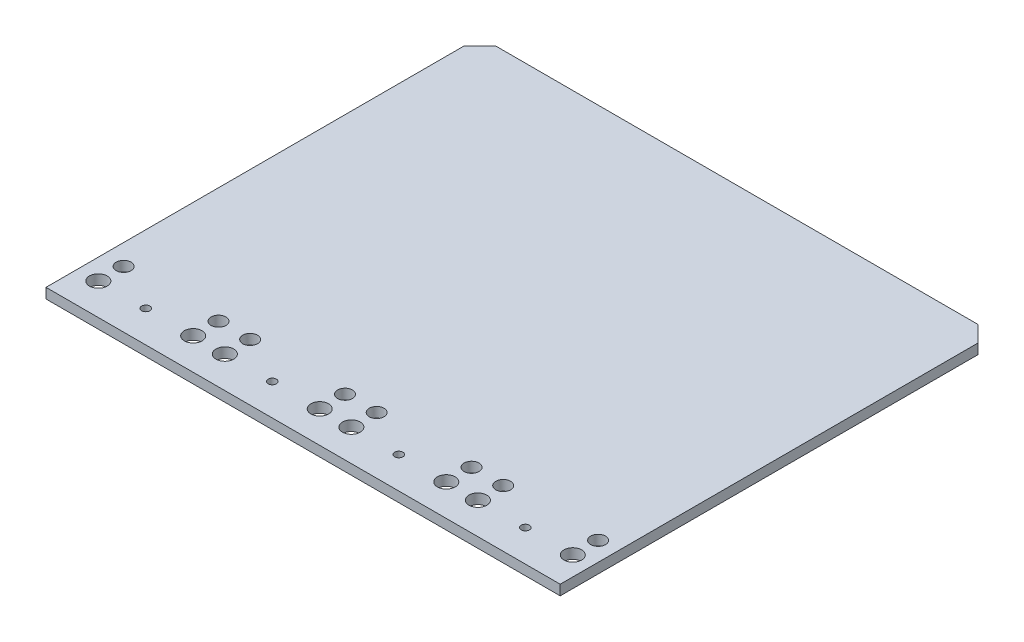
from build123d import *

# Parameters (mm, degrees)
SKETCH1_W           = 81.28
SKETCH1_H           = 68.58
BOSS_EXTRUDE1_DEPTH = 1.6
CHAMFER1_SIZE       = 2.54
CUT_EXTRUDE1_REACH  = 55.197
SKETCH2_R           = 0.65
SKETCH2_R_2         = 1.4
SKETCH2_R_3         = 1.175
LPATTERN1_COUNT     = 4
LPATTERN1_PITCH     = 20


with BuildPart() as part:
    # Sketch1 → Boss-Extrude1 (new body)
    with BuildSketch(Plane(origin=(0, 0, 0), x_dir=(1, 0, 0), z_dir=(0, 1, 0))):
        Rectangle(SKETCH1_W, SKETCH1_H)
    extrude(amount=BOSS_EXTRUDE1_DEPTH)

    # Chamfer1
    chamfer1_edges = [part.edges().sort_by_distance(p)[0] for p in [
        (-40.64, 0.8, -34.29),
        (40.64, 0.8, -34.29),
    ]]
    chamfer(chamfer1_edges, length=CHAMFER1_SIZE)

    # Sketch2 → Cut-Extrude1 (cut, up to next)
    with BuildSketch(Plane.XZ, mode=Mode.PRIVATE) as cut_extrude1_sk1:
        with Locations(Location((-29.87, 29.29, 0), (0, 0, 270))):
            Circle(SKETCH2_R)
    cut_extrude1_tool1 = extrude(cut_extrude1_sk1.sketch, amount=-CUT_EXTRUDE1_REACH, mode=Mode.PRIVATE) & part.part
    # Sketch2 → Cut-Extrude1 (cut, up to next)
    with BuildSketch(Plane.XZ, mode=Mode.PRIVATE) as cut_extrude1_sk2:
        with Locations(Location((-37.37, 29.29, 0), (0, 0, 270))):
            Circle(SKETCH2_R_2)
    cut_extrude1_tool2 = extrude(cut_extrude1_sk2.sketch, amount=-CUT_EXTRUDE1_REACH, mode=Mode.PRIVATE) & part.part
    # Sketch2 → Cut-Extrude1 (cut, up to next)
    with BuildSketch(Plane.XZ, mode=Mode.PRIVATE) as cut_extrude1_sk3:
        with Locations(Location((-22.37, 29.29, 0), (0, 0, 270))):
            Circle(SKETCH2_R_2)
    cut_extrude1_tool3 = extrude(cut_extrude1_sk3.sketch, amount=-CUT_EXTRUDE1_REACH, mode=Mode.PRIVATE) & part.part
    # Sketch2 → Cut-Extrude1 (cut, up to next)
    with BuildSketch(Plane.XZ, mode=Mode.PRIVATE) as cut_extrude1_sk4:
        with Locations(Location((-37.37, 25.29, 0), (0, 0, 270))):
            Circle(SKETCH2_R_3)
    cut_extrude1_tool4 = extrude(cut_extrude1_sk4.sketch, amount=-CUT_EXTRUDE1_REACH, mode=Mode.PRIVATE) & part.part
    # Sketch2 → Cut-Extrude1 (cut, up to next)
    with BuildSketch(Plane.XZ, mode=Mode.PRIVATE) as cut_extrude1_sk5:
        with Locations(Location((-22.37, 25.29, 0), (0, 0, 270))):
            Circle(SKETCH2_R_3)
    cut_extrude1_tool5 = extrude(cut_extrude1_sk5.sketch, amount=-CUT_EXTRUDE1_REACH, mode=Mode.PRIVATE) & part.part
    cut_extrude1_1 = cut_extrude1_tool1.solids().sort_by_distance((-29.87, 0, 29.29))[0]
    add(cut_extrude1_1, mode=Mode.SUBTRACT)
    cut_extrude1_2 = cut_extrude1_tool2.solids().sort_by_distance((-37.37, 0, 29.29))[0]
    add(cut_extrude1_2, mode=Mode.SUBTRACT)
    cut_extrude1_3 = cut_extrude1_tool3.solids().sort_by_distance((-22.37, 0, 29.29))[0]
    add(cut_extrude1_3, mode=Mode.SUBTRACT)
    cut_extrude1_4 = cut_extrude1_tool4.solids().sort_by_distance((-37.37, 0, 25.29))[0]
    add(cut_extrude1_4, mode=Mode.SUBTRACT)
    cut_extrude1_5 = cut_extrude1_tool5.solids().sort_by_distance((-22.37, 0, 25.29))[0]
    add(cut_extrude1_5, mode=Mode.SUBTRACT)
    cut_extrude1 = cut_extrude1_1 + cut_extrude1_2 + cut_extrude1_3 + cut_extrude1_4 + cut_extrude1_5  # Cut-Extrude1 as one shape, for the pattern or mirror that repeats it

    # LPattern1: Cut-Extrude1 ×4
    with Locations(*[(i * LPATTERN1_PITCH, 0, 0) for i in range(1, LPATTERN1_COUNT)]):
        add(cut_extrude1, mode=Mode.SUBTRACT)


solid = part.part
